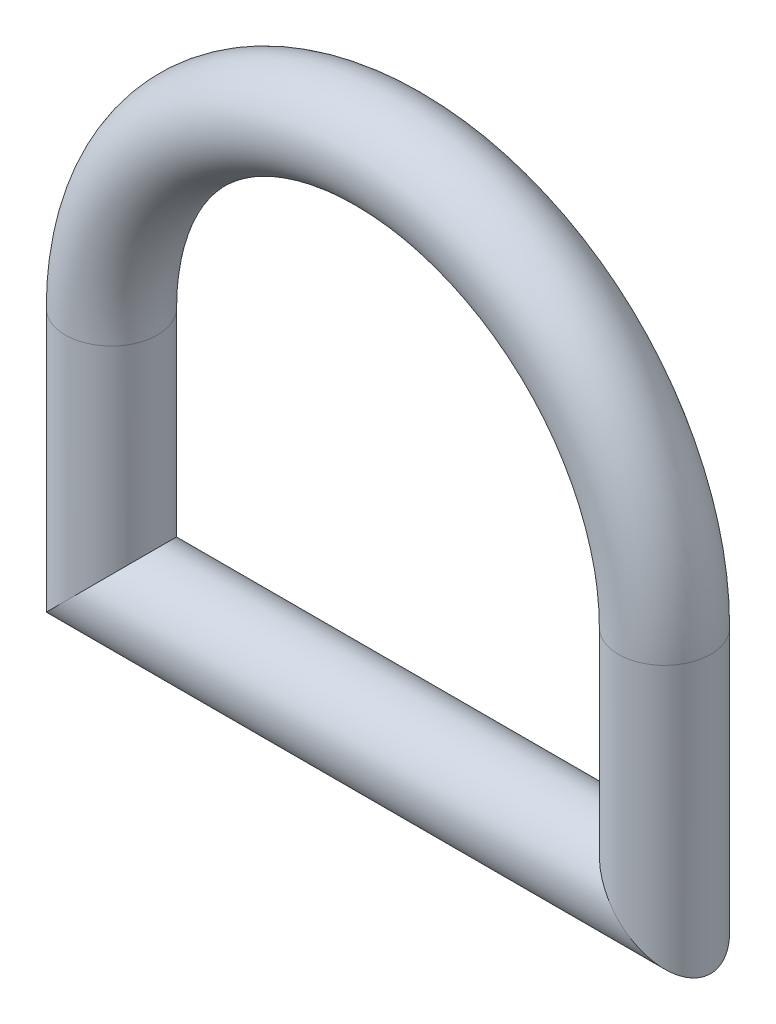
from build123d import *

# Parameters (mm, degrees)
SKETCH2_R = 3.175


with BuildPart() as part:
    # Sweep1: sweep along a path in Sketch1
    with BuildLine(Plane.XY) as sweep1_path:
        Line((0, 0), (19.05, 0))
        Line((19.05, 0), (19.05, 15.875))
        ThreePointArc((19.05, 15.875), (0, 34.925), (-19.05, 15.875))
        Line((-19.05, 15.875), (-19.05, 0))
        Line((-19.05, 0), (0, 0))
    # Sketch2 → Sweep1 (sweep)
    with BuildSketch(Plane(origin=(0, 0, 0), x_dir=(1, 0, 0), z_dir=(0, 1, 0))):
        with Locations((19.05, 0)):
            Circle(SKETCH2_R)
    sweep(path=sweep1_path.line, transition=Transition.RIGHT)


solid = part.part
